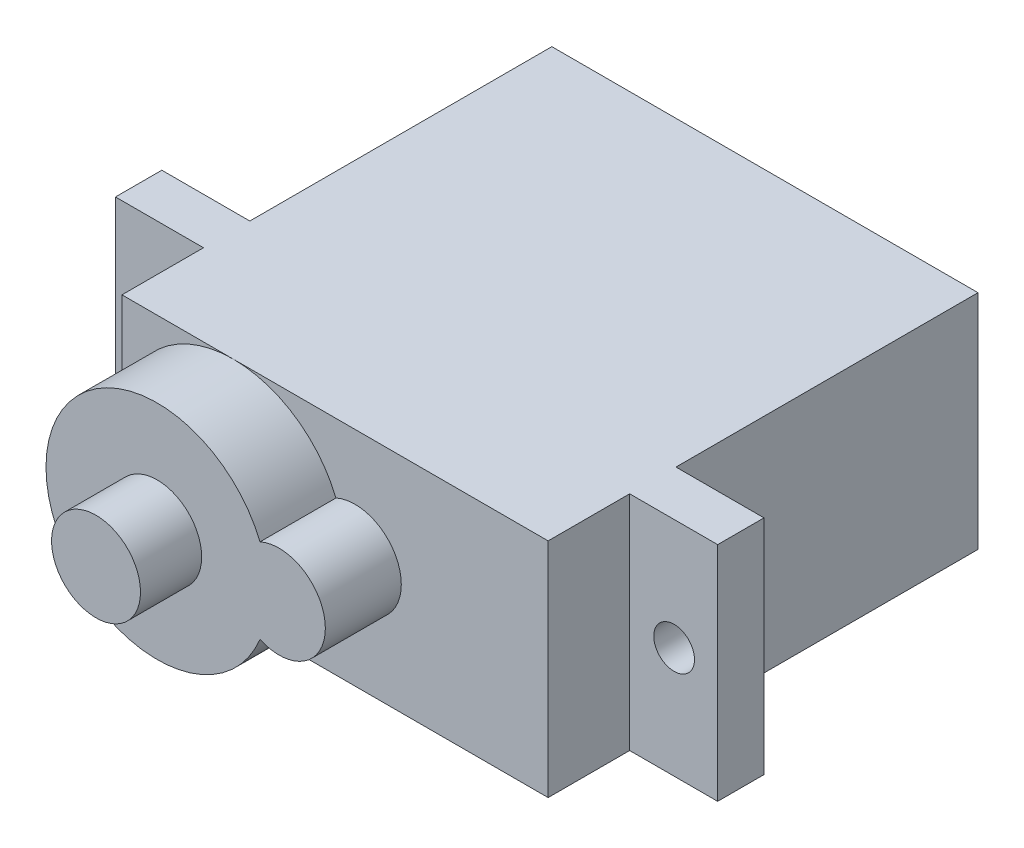
from build123d import *

# Parameters (mm, degrees)
SKETCH_1_W      = 23
SKETCH_1_H      = 12
EXTRUDE_1_DEPTH = 16.3
SKETCH_2_W      = 32.5
SKETCH_2_H      = 12
SKETCH_2_R      = 1.1
EXTRUDE_2_DEPTH = 2.5
SKETCH_3_W      = 23
SKETCH_3_H      = 12
EXTRUDE_3_DEPTH = 4.4
EXTRUDE_4_DEPTH = 4.1
SKETCH_5_R      = 2.4
EXTRUDE_5_DEPTH = 3.3


with BuildPart() as part:
    # 草图1 → 凸台-拉伸1 (new body)
    with BuildSketch(Plane.XY):
        Rectangle(SKETCH_1_W, SKETCH_1_H)
    extrude(amount=EXTRUDE_1_DEPTH)

    # 草图2 → 凸台-拉伸2 (add)
    with BuildSketch(Plane.XY.offset(16.3)):
        Rectangle(SKETCH_2_W, SKETCH_2_H)
        with Locations((-13.9, 0)):
            Circle(SKETCH_2_R, mode=Mode.SUBTRACT)
        with Locations((13.9, 0)):
            Circle(SKETCH_2_R, mode=Mode.SUBTRACT)
    extrude(amount=EXTRUDE_2_DEPTH)

    # 草图3 → 凸台-拉伸3 (add)
    with BuildSketch(Plane.XY.offset(18.8)):
        Rectangle(SKETCH_3_W, SKETCH_3_H)
    extrude(amount=EXTRUDE_3_DEPTH)

    # 草图4 → 凸台-拉伸4 (add)
    with BuildSketch(Plane.XY.offset(23.2)):
        with BuildLine():
            ThreePointArc((0.049982862, 2.279844344), (-11.5, 0), (0.049982862, -2.279844344))
            ThreePointArc((0.049982862, -2.279844344), (3.575804369, 0), (0.049982862, 2.279844344))
        make_face()
    extrude(amount=EXTRUDE_4_DEPTH)

    # 草图5 → 凸台-拉伸5 (add)
    with BuildSketch(Plane.XY.offset(27.3)):
        with Locations((-5.5, 0)):
            Circle(SKETCH_5_R)
    extrude(amount=EXTRUDE_5_DEPTH)


solid = part.part
